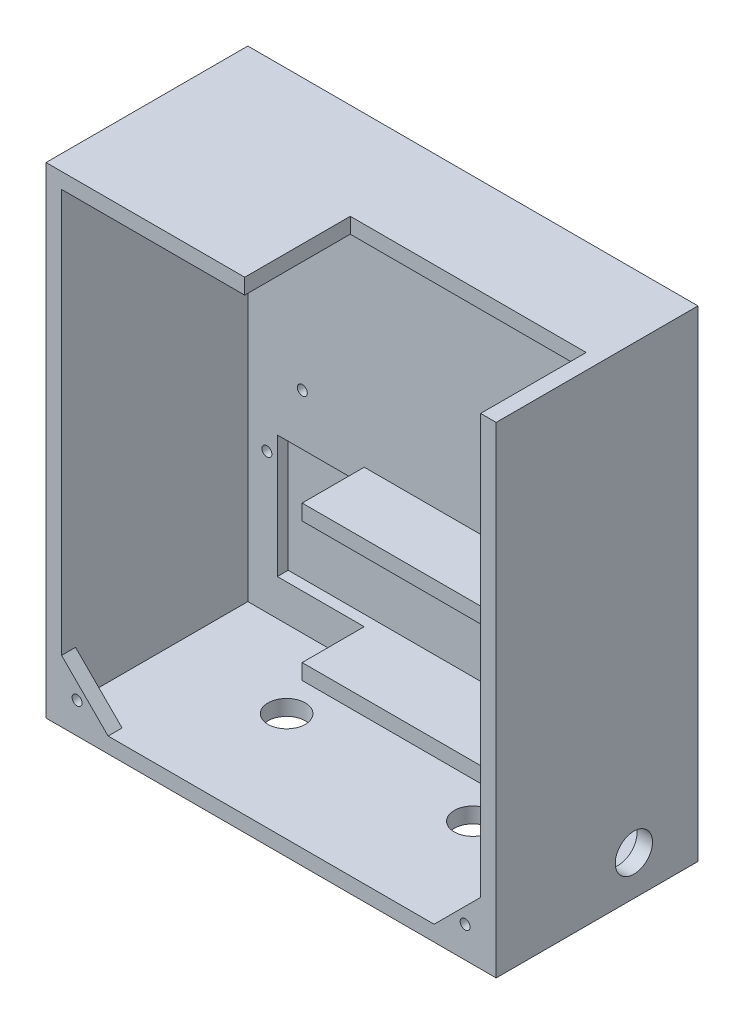
from build123d import *

# Parameters (mm, degrees)
SKETCH_1_W          = 145
SKETCH_1_H          = 155
SKETCH_1_R          = 1.6
EXTRUDE_1_DEPTH     = 5
SKETCH_2_W          = 60
SKETCH_2_H          = 5
EXTRUDE_2_DEPTH     = 20
SKETCH_3_W          = 145
SKETCH_3_H          = 155
SKETCH_3_W_2        = 135
SKETCH_3_H_2        = 145
EXTRUDE_3_DEPTH     = 60
SKETCH_8_R          = 1.6
EXTRUDE_7_DEPTH     = 4.5
SKETCH_9_W          = 76
SKETCH_9_H          = 90
CUT_EXTRUDE_1_DEPTH = 10
CUT_EXTRUDE_2_DEPTH = 3.5
SKETCH_14_R         = 6
CUT_EXTRUDE_3_DEPTH = 10
SKETCH_15_R         = 6
CUT_EXTRUDE_4_DEPTH = 10


with BuildPart() as part:
    # 草图1 → 凸台-拉伸1 (new body)
    with BuildSketch(Plane.XY):
        with Locations((0, -18.75)):
            Rectangle(SKETCH_1_W, SKETCH_1_H)
        with Locations(Location((-61.35, 46.25, 0), (0, 0, 180))):
            Circle(SKETCH_1_R, mode=Mode.SUBTRACT)
        with Locations(Location((61.35, -46.6, 0), (0, 0, 180))):
            Circle(SKETCH_1_R, mode=Mode.SUBTRACT)
        with Locations(Location((61.35, 46.6, 0), (0, 0, 180))):
            Circle(SKETCH_1_R, mode=Mode.SUBTRACT)
        with Locations(Location((-61.35, -46.25, 0), (0, 0, 180))):
            Circle(SKETCH_1_R, mode=Mode.SUBTRACT)
        with Locations(Location((62.35, 31.5, 0), (0, 0, 180))):
            Circle(SKETCH_1_R, mode=Mode.SUBTRACT)
        with Locations(Location((62.35, -23.5, 0), (0, 0, 180))):
            Circle(SKETCH_1_R, mode=Mode.SUBTRACT)
        with Locations(Location((-49.95, 31.5, 0), (0, 0, 180))):
            Circle(SKETCH_1_R, mode=Mode.SUBTRACT)
        with Locations(Location((-49.95, -23.5, 0), (0, 0, 180))):
            Circle(SKETCH_1_R, mode=Mode.SUBTRACT)
    extrude(amount=EXTRUDE_1_DEPTH)

    # 草图2 → 凸台-拉伸2 (add)
    with BuildSketch(Plane.XY.offset(5)):
        with Locations((0, -37.5)):
            Rectangle(SKETCH_2_W, SKETCH_2_H)
        with Locations((0, -82)):
            Rectangle(SKETCH_2_W, SKETCH_2_H)
    extrude(amount=EXTRUDE_2_DEPTH)

    # 草图3 → 凸台-拉伸3 (add)
    with BuildSketch(Plane.XY.offset(5)):
        with Locations((0, -18.75)):
            Rectangle(SKETCH_3_W, SKETCH_3_H)
        with Locations((0, -18.75)):
            Rectangle(SKETCH_3_W_2, SKETCH_3_H_2, mode=Mode.SUBTRACT)
    extrude(amount=EXTRUDE_3_DEPTH)

    # 草图8 → 凸台-拉伸7 (add)
    # profile 1 of 2: a face of its own
    with BuildSketch(Plane.XY.offset(65)):
        Polygon((-67.5, -76.25), (-52.5, -91.25), (-67.5, -91.25), align=None)
        with Locations((-62.5, -86.25)):
            Circle(SKETCH_8_R, mode=Mode.SUBTRACT)
    # profile 2 of 2: a face of its own
    with BuildSketch(Plane.XY.offset(65)):
        Polygon((67.5, -91.25), (52.5, -91.25), (67.5, -76.25), align=None)
        with Locations(Location((62.5, -86.25, 0), (0, 0, 180))):
            Circle(SKETCH_8_R, mode=Mode.SUBTRACT)
    extrude(amount=-EXTRUDE_7_DEPTH)

    # 草图9 → 切除-拉伸1 (cut)
    with BuildSketch(Plane.XZ.offset(-53.75)):
        with Locations((29.5, 76)):
            Rectangle(SKETCH_9_W, SKETCH_9_H)
    extrude(amount=-CUT_EXTRUDE_1_DEPTH, mode=Mode.SUBTRACT)

    # 草图13 → 切除-拉伸2 (cut)
    with BuildSketch(Plane.XY.offset(5)):
        Polygon((-30, -79.5), (-58, -79.5), (-58, -40), (58, -40), (58, -79.5), align=None)
    extrude(amount=-CUT_EXTRUDE_2_DEPTH, mode=Mode.SUBTRACT)

    # 草图14 → 切除-拉伸3 (cut)
    with BuildSketch(Plane(origin=(72.5, 0, 0), x_dir=(0, 0, -1), z_dir=(1, 0, 0))):
        with Locations(Location((-20.643106149, -83.462816737, 0), (0, 0, 90))):
            Circle(SKETCH_14_R)
    extrude(amount=-CUT_EXTRUDE_3_DEPTH, mode=Mode.SUBTRACT)

    # 草图15 → 切除-拉伸4 (cut)
    with BuildSketch(Plane(origin=(0, -96.25, 0), x_dir=(-1, 0, 0), z_dir=(0, -1, 0))):
        with Locations(Location((-30, -30, 0), (0, 0, 180))):
            Circle(SKETCH_15_R)
        with Locations(Location((30, -30, 0), (0, 0, 270))):
            Circle(SKETCH_15_R)
    extrude(amount=-CUT_EXTRUDE_4_DEPTH, mode=Mode.SUBTRACT)


solid = part.part
